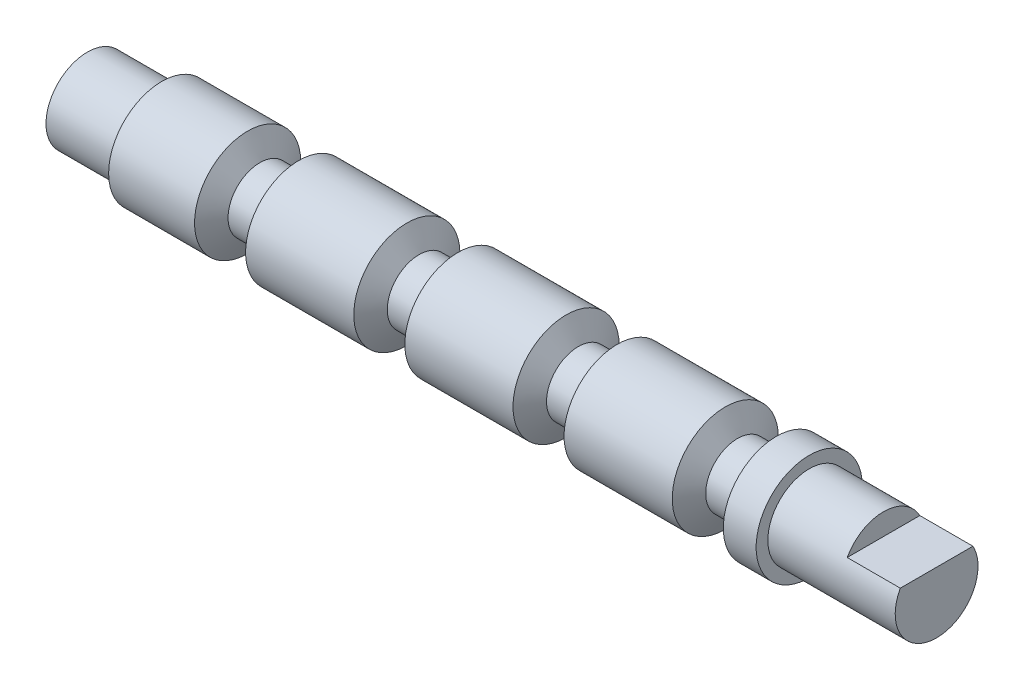
from build123d import *

# Parameters (mm, degrees)
CUT_EXTRUDE2_START = -7
SKETCH4_R          = 5
SKETCH4_R_2        = 3.9
CUT_EXTRUDE2_DEPTH = 7
SKETCH3_R          = 5
SKETCH3_R_2        = 3.9
CUT_EXTRUDE4_DEPTH = 12
CUT_EXTRUDE5_DEPTH = 5


with BuildPart() as part:
    # Sketch2 → Revolve1 (revolve)
    with BuildSketch(Plane(origin=(0, 0, 0), x_dir=(1, 0, 0), z_dir=(0, 1, 0))):
        Polygon((40, -5), (-40, -5), (-40, 0), (-30.049059985, 0), (-24.904700538, 0), (-23.75, -2), (-21.25, -2), (-20.095299462, 0), (-9.904700538, 0), (-8.75, -2), (-6.25, -2), (-5.095299462, 0), (5.095299462, 0), (6.25, -2), (8.75, -2), (9.904700538, 0), (20.095299462, 0), (21.25, -2), (23.75, -2), (24.904700538, 0), (30.049059985, 0), (40, 0), align=None)
    revolve(axis=Axis((40, 0, 5), (-1, 0, 0)))

    # Sketch4 → Cut-Extrude2 (cut)
    with BuildSketch(Plane.ZY.offset(40).offset(CUT_EXTRUDE2_START)):
        with Locations(Location((5, 0, 0), (0, 0, 180))):
            Circle(SKETCH4_R)
        with Locations((5, 0)):
            Circle(SKETCH4_R_2, mode=Mode.SUBTRACT)
    extrude(amount=CUT_EXTRUDE2_DEPTH, mode=Mode.SUBTRACT)

    # Sketch3 → Cut-Extrude4 (cut)
    with BuildSketch(Plane(origin=(40, 0, 0), x_dir=(0, 0, -1), z_dir=(1, 0, 0))):
        with Locations((-5, 0)):
            Circle(SKETCH3_R)
        with Locations(Location((-5, 0, 0), (0, 0, 180))):
            Circle(SKETCH3_R_2, mode=Mode.SUBTRACT)
    extrude(amount=-CUT_EXTRUDE4_DEPTH, mode=Mode.SUBTRACT)

    # Sketch5 → Cut-Extrude5 (cut)
    with BuildSketch(Plane(origin=(40, 0, 0), x_dir=(0, 0, -1), z_dir=(1, 0, 0))):
        with BuildLine():
            Line((-8.421971662, 1.870858078), (-1.578028338, 1.870858078))
            ThreePointArc((-1.578028338, 1.870858078), (-5, 3.9), (-8.421971662, 1.870858078))
        make_face()
    extrude(amount=-CUT_EXTRUDE5_DEPTH, mode=Mode.SUBTRACT)


solid = part.part
